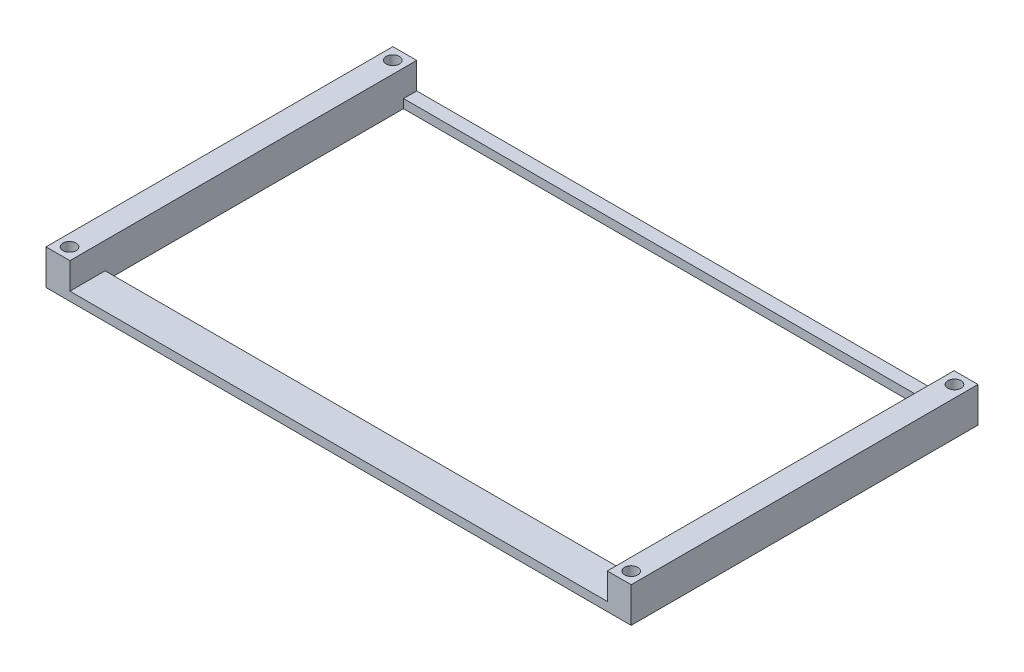
from build123d import *

# Parameters (mm, degrees)
SKETCH1_W           = 132.84
SKETCH1_H           = 78.74
SKETCH1_W_2         = 122
SKETCH1_H_2         = 67.74
SKETCH1_R           = 1.5
BOSS_EXTRUDE1_DEPTH = 2
SKETCH1_5_W         = 5.42
SKETCH1_5_H         = 78.74
SKETCH1_5_R         = 1.5
BOSS_EXTRUDE3_DEPTH = 8


with BuildPart() as part:
    # Sketch1 → Boss-Extrude1 (new body)
    with BuildSketch(Plane(origin=(0, 0, 0), x_dir=(1, 0, 0), z_dir=(0, 1, 0))):
        Rectangle(SKETCH1_W, SKETCH1_H)
        with Locations((0, 2.5)):
            Rectangle(SKETCH1_W_2, SKETCH1_H_2, mode=Mode.SUBTRACT)
        with Locations((-63.75, -36.7)):
            Circle(SKETCH1_R, mode=Mode.SUBTRACT)
        with Locations((-63.75, 36.7)):
            Circle(SKETCH1_R, mode=Mode.SUBTRACT)
        with Locations((63.75, -36.7)):
            Circle(SKETCH1_R, mode=Mode.SUBTRACT)
        with Locations((63.75, 36.7)):
            Circle(SKETCH1_R, mode=Mode.SUBTRACT)
    extrude(amount=BOSS_EXTRUDE1_DEPTH)

    # Sketch1<5> → Boss-Extrude3 (add)
    # profile 1 of 2: a face of its own
    with BuildSketch(Plane(origin=(0, 0, 0), x_dir=(1, 0, 0), z_dir=(0, 1, 0))):
        with Locations((-63.71, 0)):
            Rectangle(SKETCH1_5_W, SKETCH1_5_H)
        with Locations((-63.75, -36.7)):
            Circle(SKETCH1_5_R, mode=Mode.SUBTRACT)
        with Locations((-63.75, 36.7)):
            Circle(SKETCH1_5_R, mode=Mode.SUBTRACT)
    # profile 2 of 2: a face of its own
    with BuildSketch(Plane(origin=(0, 0, 0), x_dir=(1, 0, 0), z_dir=(0, 1, 0))):
        with Locations((63.71, 0)):
            Rectangle(SKETCH1_5_W, SKETCH1_5_H)
        with Locations((63.75, -36.7)):
            Circle(SKETCH1_5_R, mode=Mode.SUBTRACT)
        with Locations((63.75, 36.7)):
            Circle(SKETCH1_5_R, mode=Mode.SUBTRACT)
    extrude(amount=BOSS_EXTRUDE3_DEPTH)


solid = part.part
